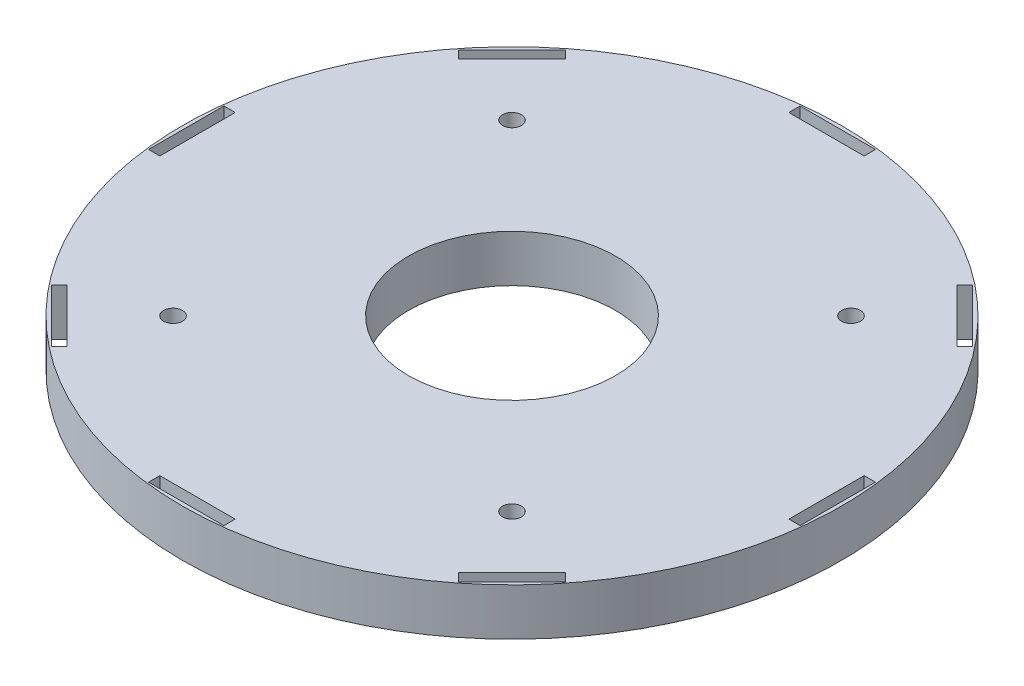
from build123d import *

# Parameters (mm, degrees)
SKETCH1_R           = 175
SKETCH1_R_2         = 55
BOSS_EXTRUDE1_DEPTH = 12.5
SKETCH2_W           = 40
SKETCH2_H           = 6
SKETCH2_W_2         = 6
SKETCH2_H_2         = 40
CUT_EXTRUDE2_DEPTH  = 249.746859277
SKETCH3_R           = 5
CUT_EXTRUDE3_DEPTH  = 249.746859277


with BuildPart() as part:
    # Sketch1 → Boss-Extrude1 (new, symmetric)
    with BuildSketch(Plane(origin=(0, 0, 0), x_dir=(1, 0, 0), z_dir=(0, 1, 0))):
        with Locations(Location((0, 0, 0), (0, 0, 270))):
            Circle(SKETCH1_R)
        with Locations(Location((0, 0, 0), (0, 0, 270))):
            Circle(SKETCH1_R_2, mode=Mode.SUBTRACT)
    extrude(amount=BOSS_EXTRUDE1_DEPTH, both=True)

    # Sketch2 → Cut-Extrude2 (cut, through all)
    with BuildSketch(Plane(origin=(0, 12.5, 0), x_dir=(1, 0, 0), z_dir=(0, 1, 0))):
        with Locations((0, 170)):
            Rectangle(SKETCH2_W, SKETCH2_H)
        Polygon((103.944696834, 132.228968082), (132.228968082, 103.944696834), (136.471608769, 108.187337522), (108.187337522, 136.471608769), align=None)
        with Locations((170, 0)):
            Rectangle(SKETCH2_W_2, SKETCH2_H_2)
        Polygon((132.228968082, -103.944696834), (103.944696834, -132.228968082), (108.187337522, -136.471608769), (136.471608769, -108.187337522), align=None)
        with Locations((0, -170)):
            Rectangle(SKETCH2_W, SKETCH2_H)
        Polygon((-103.944696834, -132.228968082), (-132.228968082, -103.944696834), (-136.471608769, -108.187337522), (-108.187337522, -136.471608769), align=None)
        with Locations((-170, 0)):
            Rectangle(SKETCH2_W_2, SKETCH2_H_2)
        Polygon((-132.228968082, 103.944696834), (-103.944696834, 132.228968082), (-108.187337522, 136.471608769), (-136.471608769, 108.187337522), align=None)
    extrude(amount=-CUT_EXTRUDE2_DEPTH, mode=Mode.SUBTRACT)

    # Sketch3 → Cut-Extrude3 (cut, through all)
    with BuildSketch(Plane(origin=(0, 12.5, 0), x_dir=(1, 0, 0), z_dir=(0, 1, 0))):
        with Locations(Location((-90, 90, 0), (0, 0, 270))):
            Circle(SKETCH3_R)
        with Locations(Location((90, 90, 0), (0, 0, 90))):
            Circle(SKETCH3_R)
        with Locations(Location((90, -90, 0), (0, 0, 270))):
            Circle(SKETCH3_R)
        with Locations(Location((-90, -90, 0), (0, 0, 90))):
            Circle(SKETCH3_R)
    extrude(amount=-CUT_EXTRUDE3_DEPTH, mode=Mode.SUBTRACT)


solid = part.part
